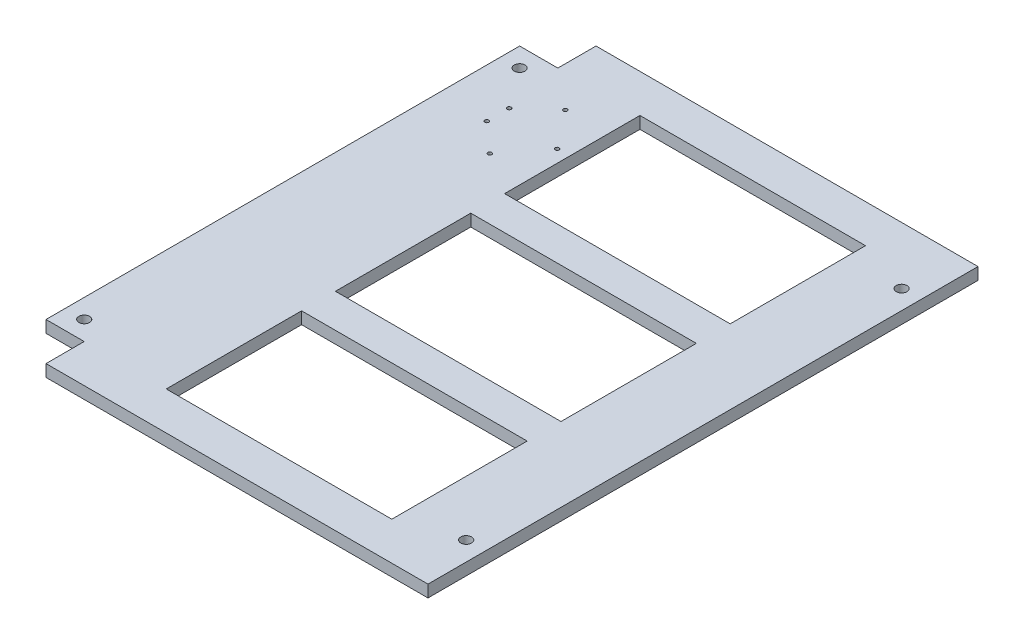
from build123d import *

# Parameters (mm, degrees)
BOSS_EXTRUDE1_DEPTH = 8
SKETCH2_R           = 3.57
CUT_EXTRUDE1_DEPTH  = 248.966140282
SKETCH3_R           = 1.3
CUT_EXTRUDE2_DEPTH  = 248.966140282
SKETCH5_W           = 150
SKETCH5_H           = 90
CUT_EXTRUDE3_DEPTH  = 248.966140282


with BuildPart() as part:
    # Sketch1 → Boss-Extrude1 (new body)
    with BuildSketch(Plane(origin=(0, 0, 0), x_dir=(1, 0, 0), z_dir=(0, 1, 0))):
        Polygon((113.643595506, 184.24988764), (-140.356404494, 184.24988764), (-140.356404494, 158.84988764), (-165.756404494, 158.84988764), (-165.756404494, -156.11011236), (-140.356404494, -156.11011236), (-140.356404494, -181.51011236), (113.643595506, -181.51011236), align=None)
    extrude(amount=BOSS_EXTRUDE1_DEPTH)

    # Sketch2 → Cut-Extrude1 (cut, through all)
    with BuildSketch(Plane(origin=(0, 8, 0), x_dir=(1, 0, 0), z_dir=(0, 1, 0))):
        with Locations((-153.056404494, -143.39011236)):
            Circle(SKETCH2_R)
        with Locations((100.943595506, 146.12988764)):
            Circle(SKETCH2_R)
        with Locations((100.943595506, -143.39011236)):
            Circle(SKETCH2_R)
        with Locations((-153.056404494, 146.12988764)):
            Circle(SKETCH2_R)
    extrude(amount=-CUT_EXTRUDE1_DEPTH, mode=Mode.SUBTRACT)

    # Sketch3 → Cut-Extrude2 (cut, through all)
    with BuildSketch(Plane(origin=(0, 8, 0), x_dir=(1, 0, 0), z_dir=(0, 1, 0))):
        with Locations((-133.405641044, 119.531092968)):
            Circle(SKETCH3_R)
        with Locations((-133.405641044, 104.641092968)):
            Circle(SKETCH3_R)
        with Locations((-113.748141044, 86.971092968)):
            Circle(SKETCH3_R)
        with Locations((-94.090641044, 112.086092968)):
            Circle(SKETCH3_R)
        with Locations((-113.748141044, 137.201092968)):
            Circle(SKETCH3_R)
    extrude(amount=-CUT_EXTRUDE2_DEPTH, mode=Mode.SUBTRACT)

    # Sketch5 → Cut-Extrude3 (cut, through all)
    with BuildSketch(Plane(origin=(0, 8, 0), x_dir=(1, 0, 0), z_dir=(0, 1, 0))):
        with Locations((-10.756404494, 113.84988764)):
            Rectangle(SKETCH5_W, SKETCH5_H)
        with Locations((-10.756404494, 1.34988764)):
            Rectangle(SKETCH5_W, SKETCH5_H)
        with Locations((-10.756404494, -111.15011236)):
            Rectangle(SKETCH5_W, SKETCH5_H)
    extrude(amount=-CUT_EXTRUDE3_DEPTH, mode=Mode.SUBTRACT)


solid = part.part
